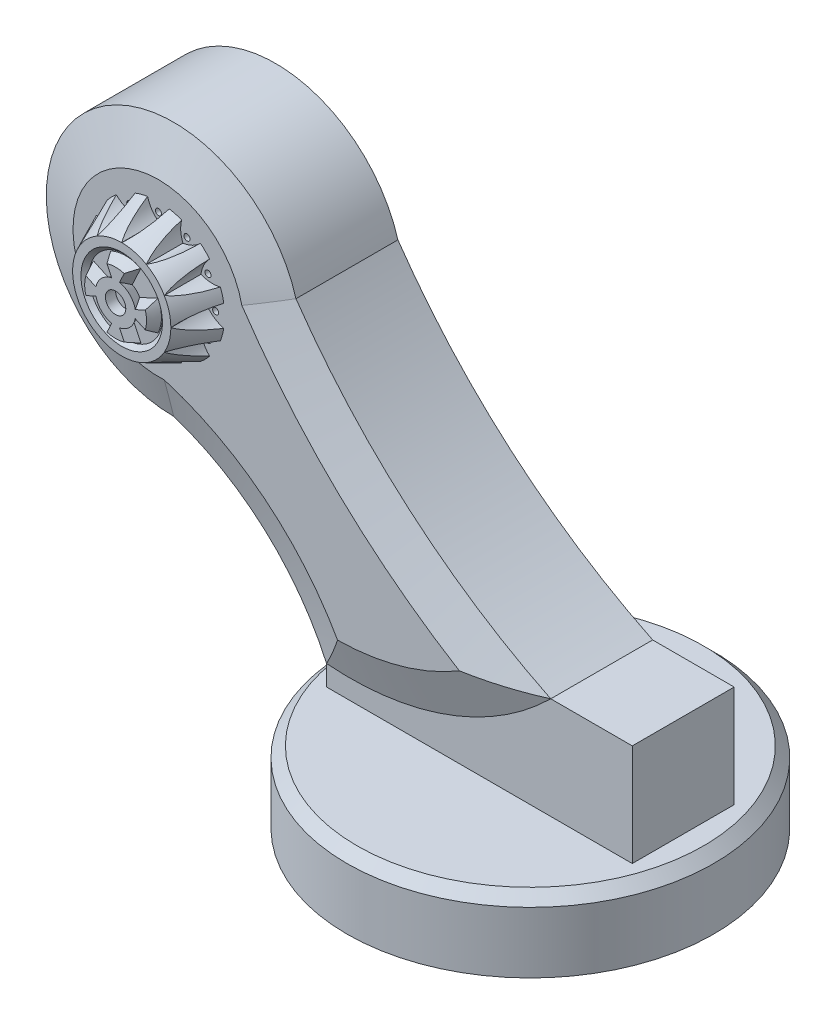
from build123d import *

# Parameters (mm, degrees)
SKETCH1_R                = 90
BOSS_EXTRUDE1_DEPTH      = 35
CHAMFER1_SIZE            = 5
SKETCH2_W                = 150
SKETCH2_H                = 50
BOSS_EXTRUDE2_DEPTH      = 50
CUT_EXTRUDE1_DEPTH       = 50
BOSS_EXTRUDE3_DEPTH      = 25
BOSS_EXTRUDE5_DEPTH      = 7.5
BOSS_EXTRUDE5_DRAFT      = 70
SKETCH7_R                = 32.5
BOSS_EXTRUDE6_DEPTH      = 18
BOSS_EXTRUDE6_TAPER      = 25
CUT_EXTRUDE2_DEPTH       = 18
SKETCH10_R               = 1.5
CUT_EXTRUDE3_DEPTH       = 5
CIRPATTERN1_COUNT        = 12
SKETCH11_R               = 20
CUT_EXTRUDE4_DEPTH       = 2
CUT_EXTRUDE4_DRAFT       = -45
BOSS_EXTRUDE7_DEPTH      = 5
BOSS_EXTRUDE7_DRAFT      = 25
CIRPATTERN2_COPY_1_DEPTH = 5
CIRPATTERN2_COPY_1_DRAFT = 25
CIRPATTERN2_COPY_2_DEPTH = 5
CIRPATTERN2_COPY_2_DRAFT = 25
CIRPATTERN2_COPY_3_DEPTH = 5
CIRPATTERN2_COPY_3_DRAFT = 25
SKETCH13_R               = 7.5
BOSS_EXTRUDE8_DEPTH      = 5
BOSS_EXTRUDE8_DRAFT      = -25
SKETCH14_R               = 5
CUT_EXTRUDE5_DEPTH       = 5
SKETCH15_R               = 15
CUT_EXTRUDE6_DEPTH       = 25
SKETCH16_R               = 10.25
CUT_EXTRUDE7_DEPTH       = 20.1


with BuildPart() as part:
    # Sketch1 → Boss-Extrude1 (new body)
    with BuildSketch(Plane(origin=(0, 0, 0), x_dir=(1, 0, 0), z_dir=(0, 1, 0))):
        with Locations(Location((0, 0, 0), (0, 0, 270))):
            Circle(SKETCH1_R)
    extrude(amount=BOSS_EXTRUDE1_DEPTH)

    # Chamfer1
    chamfer1_edges = [part.edges().sort_by_distance(p)[0] for p in [
        (0, 35, -90),
    ]]
    chamfer(chamfer1_edges, length=CHAMFER1_SIZE)

    # Sketch2 → Boss-Extrude2 (add)
    with BuildSketch(Plane(origin=(0, 35, 0), x_dir=(1, 0, 0), z_dir=(0, 1, 0))):
        Rectangle(SKETCH2_W, SKETCH2_H)
    extrude(amount=BOSS_EXTRUDE2_DEPTH)

    # Sketch4 → Cut-Extrude1 (cut)
    with BuildSketch(Plane.XY.offset(25)):
        with BuildLine():
            Line((-75, 45), (-75, 85))
            Line((-75, 85), (35, 85))
            ThreePointArc((35, 85), (-15.619186591, 52.952763124), (-75, 45))
        make_face()
    extrude(amount=-CUT_EXTRUDE1_DEPTH, mode=Mode.SUBTRACT)


with BuildPart() as body_2:
    # Sketch5 → Boss-Extrude3 (new, symmetric)
    with BuildSketch(Plane.XY):
        with BuildLine():
            ThreePointArc((-90, 192.5), (-200, 212.5), (-150, 112.5))
            ThreePointArc((-150, 112.5), (-105.386537724, 86.653846973), (-75, 45))
            ThreePointArc((-75, 45), (-15.619186591, 52.952763124), (35, 85))
            ThreePointArc((35, 85), (-34.429942711, 130.69192708), (-90, 192.5))
        make_face()
    extrude(amount=BOSS_EXTRUDE3_DEPTH, both=True)


with BuildPart() as boss_extrude5_tool:
    # Sketch6 → Boss-Extrude5 (with draft: the straight prism first)
    with BuildSketch(Plane.XY.offset(25)):
        with BuildLine():
            ThreePointArc((-75, 45), (-15.619186591, 52.952763124), (35, 85))
            ThreePointArc((35, 85), (-34.429942711, 130.69192708), (-90, 192.5))
            ThreePointArc((-90, 192.5), (-200, 212.5), (-150, 112.5))
            ThreePointArc((-150, 112.5), (-105.386537724, 86.653846973), (-75, 45))
        make_face()
    extrude(amount=BOSS_EXTRUDE5_DEPTH)
    # Boss-Extrude5: the draft: its side faces are tilted about the plane it starts from
    boss_extrude5_sides = [boss_extrude5_tool.faces().sort_by_distance(p)[0] for p in [
        (-34.429942711, 130.69192708, 28.75),
        (-200, 212.5, 28.75),
        (-105.386537724, 86.653846973, 28.75),
        (-15.619186591, 52.952763124, 28.75),
    ]]
    draft(boss_extrude5_sides, Plane.XY.offset(25), BOSS_EXTRUDE5_DRAFT)


with BuildPart() as part_1:
    add(part.part)

    # Boss-Extrude5: add boss_extrude5_tool
    add(boss_extrude5_tool.part)

    add(body_2.part)  # Boss-Extrude5 merges body 2

    # Sketch7 → Boss-Extrude6 (add)
    with BuildSketch(Plane.XY.offset(32.5)):
        with Locations((-150, 175)):
            Circle(SKETCH7_R)
    extrude(amount=BOSS_EXTRUDE6_DEPTH, taper=BOSS_EXTRUDE6_TAPER)

    # Sketch9 → Cut-Extrude2 (cut)
    with BuildSketch(Plane.XY.offset(50.5)):
        with BuildLine():
            ThreePointArc((-150, 199.106462153), (-146.688619677, 202.648411145), (-144.68013321, 207.061644021))
            ThreePointArc((-144.68013321, 207.061644021), (-150, 207.5), (-155.31986679, 207.061644021))
            ThreePointArc((-155.31986679, 207.061644021), (-153.311380323, 202.648411145), (-150, 199.106462153))
        make_face()
    cut_extrude2 = extrude(amount=-CUT_EXTRUDE2_DEPTH, mode=Mode.SUBTRACT)

    # Sketch10 → Cut-Extrude3 (cut)
    with BuildSketch(Plane.XY.offset(32.5)):
        with Locations((-150, 203.084053087)):
            Circle(SKETCH10_R)
    cut_extrude3 = extrude(amount=-CUT_EXTRUDE3_DEPTH, mode=Mode.SUBTRACT)

    # CirPattern1: Cut-Extrude2, Cut-Extrude3 ×12 about axis
    cirpattern1_axis = Axis((-150, 175, 0), (0, 0, 1))
    add([cut_extrude2.rotate(cirpattern1_axis, i * 360 / CIRPATTERN1_COUNT) for i in range(1, CIRPATTERN1_COUNT)], mode=Mode.SUBTRACT)
    add([cut_extrude3.rotate(cirpattern1_axis, i * 360 / CIRPATTERN1_COUNT) for i in range(1, CIRPATTERN1_COUNT)], mode=Mode.SUBTRACT)


with BuildPart() as cut_extrude4_tool:
    # Sketch11 → Cut-Extrude4 (with draft: the straight prism first)
    with BuildSketch(Plane.XY.offset(50.5)):
        with Locations((-150, 175)):
            Circle(SKETCH11_R)
    extrude(amount=-CUT_EXTRUDE4_DEPTH)
    # Cut-Extrude4: the draft: its side faces are tilted about the plane it starts from
    cut_extrude4_sides = [cut_extrude4_tool.faces().sort_by_distance(p)[0] for p in [
        (-170, 175, 49.5),
    ]]
    draft(cut_extrude4_sides, Plane.XY.offset(50.5), CUT_EXTRUDE4_DRAFT)


with BuildPart() as part_2:
    add(part_1.part)

    # Cut-Extrude4: cut by cut_extrude4_tool
    add(cut_extrude4_tool.part, mode=Mode.SUBTRACT)


with BuildPart() as boss_extrude7_tool:
    # Sketch12 → Boss-Extrude7 (with draft: the straight prism first)
    with BuildSketch(Plane.XY.offset(48.5)):
        with BuildLine():
            ThreePointArc((-153.169636963, 181.797308403), (-150, 182.5), (-146.830363037, 181.797308403))
            Line((-146.830363037, 181.797308403), (-142.60418042, 190.860386273))
            ThreePointArc((-142.60418042, 190.860386273), (-150, 192.5), (-157.39581958, 190.860386273))
            Line((-157.39581958, 190.860386273), (-153.169636963, 181.797308403))
        make_face()
    extrude(amount=BOSS_EXTRUDE7_DEPTH)
    # Boss-Extrude7: the draft: its side faces are tilted about the plane it starts from
    boss_extrude7_sides = [boss_extrude7_tool.faces().sort_by_distance(p)[0] for p in [
        (-150, 182.5, 51),
        (-144.717271728, 186.328847338, 51),
        (-150, 192.5, 51),
        (-155.282728272, 186.328847338, 51),
    ]]
    draft(boss_extrude7_sides, Plane.XY.offset(48.5), BOSS_EXTRUDE7_DRAFT)


with BuildPart() as part_3:
    add(part_2.part)

    # Boss-Extrude7: add boss_extrude7_tool
    add(boss_extrude7_tool.part)


with BuildPart() as cirpattern2_copy_1_tool:
    # CirPattern2 copy 1 sketch → CirPattern2 copy 1 (with draft: the straight prism first)
    with BuildSketch(Plane(origin=(25, 325, 48.5), x_dir=(0, 1, 0), z_dir=(0, 0, 1))):
        with BuildLine():
            ThreePointArc((-153.169636963, 181.797308403), (-150, 182.5), (-146.830363037, 181.797308403))
            Line((-146.830363037, 181.797308403), (-142.60418042, 190.860386273))
            ThreePointArc((-142.60418042, 190.860386273), (-150, 192.5), (-157.39581958, 190.860386273))
            Line((-157.39581958, 190.860386273), (-153.169636963, 181.797308403))
        make_face()
    extrude(amount=CIRPATTERN2_COPY_1_DEPTH)
    # CirPattern2 copy 1: the draft: its side faces are tilted about the plane it starts from
    cirpattern2_copy_1_sides = [cirpattern2_copy_1_tool.faces().sort_by_distance(p)[0] for p in [
        (-157.5, 175, 51),
        (-161.328847338, 180.282728272, 51),
        (-167.5, 175, 51),
        (-161.328847338, 169.717271728, 51),
    ]]
    draft(cirpattern2_copy_1_sides, Plane(origin=(25, 325, 48.5), x_dir=(0, 1, 0), z_dir=(0, 0, 1)), CIRPATTERN2_COPY_1_DRAFT)


with BuildPart() as part_4:
    add(part_3.part)

    # CirPattern2 copy 1: add cirpattern2_copy_1_tool
    add(cirpattern2_copy_1_tool.part)


with BuildPart() as cirpattern2_copy_2_tool:
    # CirPattern2 copy 2 sketch → CirPattern2 copy 2 (with draft: the straight prism first)
    with BuildSketch(Plane(origin=(-300, 350, 48.5), x_dir=(-1, 0, 0), z_dir=(0, 0, 1))):
        with BuildLine():
            ThreePointArc((-153.169636963, 181.797308403), (-150, 182.5), (-146.830363037, 181.797308403))
            Line((-146.830363037, 181.797308403), (-142.60418042, 190.860386273))
            ThreePointArc((-142.60418042, 190.860386273), (-150, 192.5), (-157.39581958, 190.860386273))
            Line((-157.39581958, 190.860386273), (-153.169636963, 181.797308403))
        make_face()
    extrude(amount=CIRPATTERN2_COPY_2_DEPTH)
    # CirPattern2 copy 2: the draft: its side faces are tilted about the plane it starts from
    cirpattern2_copy_2_sides = [cirpattern2_copy_2_tool.faces().sort_by_distance(p)[0] for p in [
        (-150, 167.5, 51),
        (-155.282728272, 163.671152662, 51),
        (-150, 157.5, 51),
        (-144.717271728, 163.671152662, 51),
    ]]
    draft(cirpattern2_copy_2_sides, Plane(origin=(-300, 350, 48.5), x_dir=(-1, 0, 0), z_dir=(0, 0, 1)), CIRPATTERN2_COPY_2_DRAFT)


with BuildPart() as part_5:
    add(part_4.part)

    # CirPattern2 copy 2: add cirpattern2_copy_2_tool
    add(cirpattern2_copy_2_tool.part)


with BuildPart() as cirpattern2_copy_3_tool:
    # CirPattern2 copy 3 sketch → CirPattern2 copy 3 (with draft: the straight prism first)
    with BuildSketch(Plane(origin=(-325, 25, 48.5), x_dir=(0, -1, 0), z_dir=(0, 0, 1))):
        with BuildLine():
            ThreePointArc((-153.169636963, 181.797308403), (-150, 182.5), (-146.830363037, 181.797308403))
            Line((-146.830363037, 181.797308403), (-142.60418042, 190.860386273))
            ThreePointArc((-142.60418042, 190.860386273), (-150, 192.5), (-157.39581958, 190.860386273))
            Line((-157.39581958, 190.860386273), (-153.169636963, 181.797308403))
        make_face()
    extrude(amount=CIRPATTERN2_COPY_3_DEPTH)
    # CirPattern2 copy 3: the draft: its side faces are tilted about the plane it starts from
    cirpattern2_copy_3_sides = [cirpattern2_copy_3_tool.faces().sort_by_distance(p)[0] for p in [
        (-142.5, 175, 51),
        (-138.671152662, 169.717271728, 51),
        (-132.5, 175, 51),
        (-138.671152662, 180.282728272, 51),
    ]]
    draft(cirpattern2_copy_3_sides, Plane(origin=(-325, 25, 48.5), x_dir=(0, -1, 0), z_dir=(0, 0, 1)), CIRPATTERN2_COPY_3_DRAFT)


with BuildPart() as part_6:
    add(part_5.part)

    # CirPattern2 copy 3: add cirpattern2_copy_3_tool
    add(cirpattern2_copy_3_tool.part)


with BuildPart() as boss_extrude8_tool:
    # Sketch13 → Boss-Extrude8 (with draft: the straight prism first)
    with BuildSketch(Plane.XY.offset(48.5)):
        with Locations((-150, 175)):
            Circle(SKETCH13_R)
    extrude(amount=BOSS_EXTRUDE8_DEPTH)
    # Boss-Extrude8: the draft: its side faces are tilted about the plane it starts from
    boss_extrude8_sides = [boss_extrude8_tool.faces().sort_by_distance(p)[0] for p in [
        (-157.5, 175, 51),
    ]]
    draft(boss_extrude8_sides, Plane.XY.offset(48.5), BOSS_EXTRUDE8_DRAFT)


with BuildPart() as part_7:
    add(part_6.part)

    # Boss-Extrude8: add boss_extrude8_tool
    add(boss_extrude8_tool.part)

    # Sketch14 → Cut-Extrude5 (cut)
    with BuildSketch(Plane.XY.offset(53.5)):
        with Locations((-150, 175)):
            Circle(SKETCH14_R)
    extrude(amount=-CUT_EXTRUDE5_DEPTH, mode=Mode.SUBTRACT)

    # Sketch15 → Cut-Extrude6 (cut)
    with BuildSketch(Plane(origin=(0, 0, -25), x_dir=(-1, 0, 0), z_dir=(0, 0, -1))):
        with Locations((150, 175)):
            Circle(SKETCH15_R)
    extrude(amount=-CUT_EXTRUDE6_DEPTH, mode=Mode.SUBTRACT)

    # Sketch16 → Cut-Extrude7 (cut)
    with BuildSketch(Plane.XZ):
        with Locations(Location((0, 0, 0), (0, 0, 270))):
            Circle(SKETCH16_R)
    extrude(amount=-CUT_EXTRUDE7_DEPTH, mode=Mode.SUBTRACT)


solid = part_7.part
